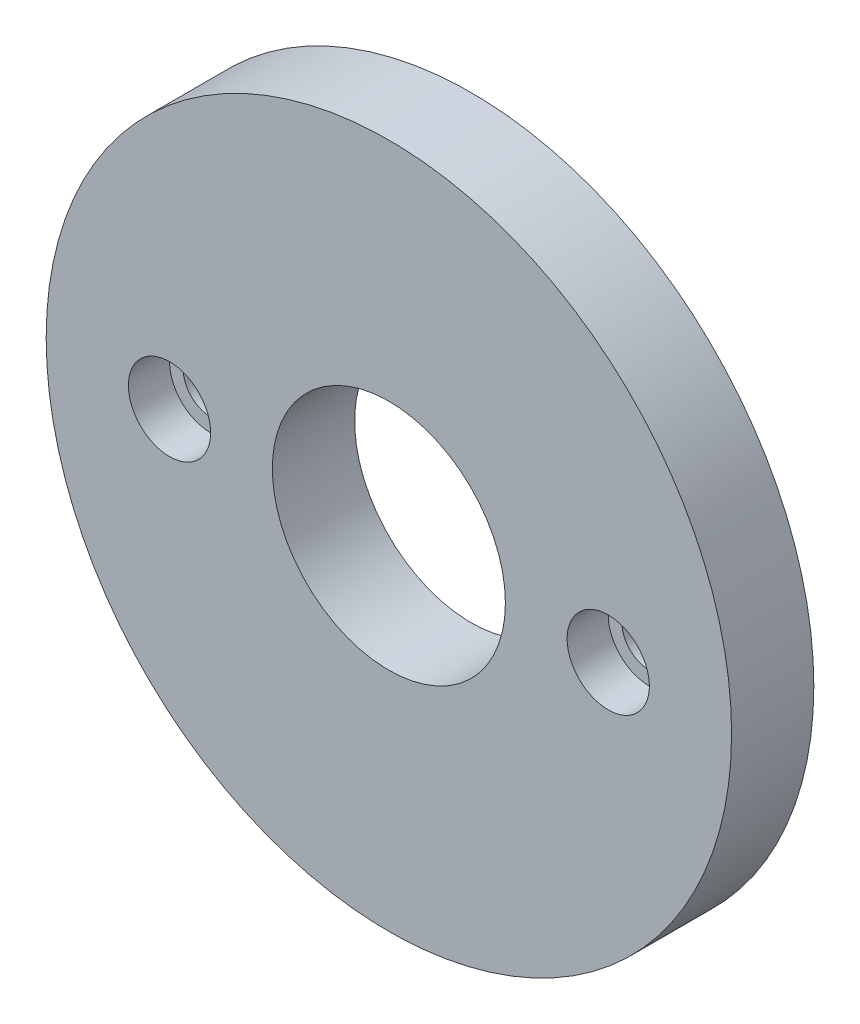
from build123d import *

# Parameters (mm, degrees)
ESQUISSE1_R             = 25
ESQUISSE1_R_2           = 8.5
BOSS_EXTRU_3_DEPTH      = 6
ESQUISSE6_R             = 3
ENL_V_MAT_EXTRU_7_DEPTH = 3
ESQUISSE7_R             = 2
ENL_V_MAT_EXTRU_8_DEPTH = 91


with BuildPart() as part:
    # Esquisse1 → Boss.-Extru.3 (new body)
    with BuildSketch(Plane.XY):
        Circle(ESQUISSE1_R)
        Circle(ESQUISSE1_R_2, mode=Mode.SUBTRACT)
    extrude(amount=BOSS_EXTRU_3_DEPTH)

    # Esquisse6 → Enlèv. mat.-Extru.7 (cut)
    with BuildSketch(Plane.XY.offset(6)):
        with Locations((-16, 0)):
            Circle(ESQUISSE6_R)
        with Locations(Location((16, 0, 0), (0, 0, 180))):
            Circle(ESQUISSE6_R)
    extrude(amount=-ENL_V_MAT_EXTRU_7_DEPTH, mode=Mode.SUBTRACT)

    # Esquisse7 → Enlèv. mat.-Extru.8 (cut)
    with BuildSketch(Plane.XY.offset(6)):
        with Locations((-16, 0)):
            Circle(ESQUISSE7_R)
        with Locations((16, 0)):
            Circle(ESQUISSE7_R)
    extrude(amount=-ENL_V_MAT_EXTRU_8_DEPTH, mode=Mode.SUBTRACT)


solid = part.part
